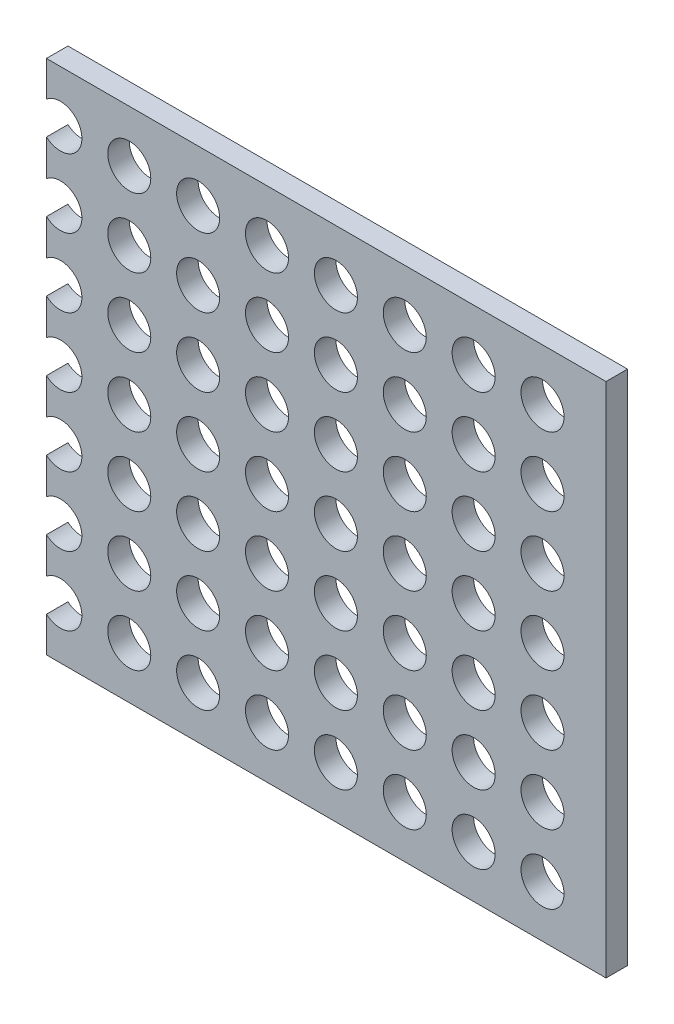
from build123d import *

# Parameters (mm, degrees)
SKETCH1_W           = 82.55
SKETCH1_H           = 76.2
BOSS_EXTRUDE1_DEPTH = 3.175
LPATTERN1_COUNT     = 5
LPATTERN1_PITCH     = 10.16
LPATTERN1_COL_COUNT = 4
LPATTERN1_COL_PITCH = 10.16
LPATTERN2_COUNT     = 4
LPATTERN2_PITCH     = 10.16
LPATTERN2_COL_COUNT = 4
LPATTERN2_COL_PITCH = 10.16


with BuildPart() as part:
    # Sketch1 → Boss-Extrude1 (new body)
    with BuildSketch(Plane.XY):
        Rectangle(SKETCH1_W, SKETCH1_H)
    extrude(amount=BOSS_EXTRUDE1_DEPTH)

    # Sketch3 → 1/4 (0.25) Diameter Hole1 (revolve, cut)
    with BuildSketch(Plane(origin=(-8.7376, 0, 3.175), x_dir=(0, -1, 0), z_dir=(1, 0, 0))):
        Polygon((0, 0), (0, 17.147732465), (3.175, 15.24), (3.175, 0), align=None)
    f_1_4_0_25_diameter_hole1 = revolve(axis=Axis((-8.7376, 0, 9.525), (0, 0, -1)), mode=Mode.SUBTRACT)

    # LPattern1: 1/4 (0.25) Diameter Hole1 ×5
    with Locations(*[(i * LPATTERN1_PITCH, 0, 0) for i in range(1, LPATTERN1_COUNT)]):
        add(f_1_4_0_25_diameter_hole1, mode=Mode.SUBTRACT)

    # LPattern1 col: 1/4 (0.25) Diameter Hole1 ×4
    with Locations(*[(-i * LPATTERN1_COL_PITCH, 0, 0) for i in range(1, LPATTERN1_COL_COUNT)]):
        add(f_1_4_0_25_diameter_hole1, mode=Mode.SUBTRACT)

    # LPattern2: 1/4 (0.25) Diameter Hole1 ×4
    with Locations(*[(0, -i * LPATTERN2_PITCH, 0) for i in range(1, LPATTERN2_COUNT)]):
        add(f_1_4_0_25_diameter_hole1, mode=Mode.SUBTRACT)

    # LPattern2 copy 1 sketch → LPattern2 copy 1 (revolve, cut)
    with BuildSketch(Plane(origin=(1.4224, -10.16, 3.175), x_dir=(0, -1, 0), z_dir=(1, 0, 0))):
        Polygon((0, 0), (0, 17.147732465), (3.175, 15.24), (3.175, 0), align=None)
    revolve(axis=Axis((1.4224, -10.16, 9.525), (0, 0, -1)), mode=Mode.SUBTRACT)

    # LPattern2 copy 2 sketch → LPattern2 copy 2 (revolve, cut)
    with BuildSketch(Plane(origin=(1.4224, -20.32, 3.175), x_dir=(0, -1, 0), z_dir=(1, 0, 0))):
        Polygon((0, 0), (0, 17.147732465), (3.175, 15.24), (3.175, 0), align=None)
    revolve(axis=Axis((1.4224, -20.32, 9.525), (0, 0, -1)), mode=Mode.SUBTRACT)

    # LPattern2 copy 3 sketch → LPattern2 copy 3 (revolve, cut)
    with BuildSketch(Plane(origin=(1.4224, -30.48, 3.175), x_dir=(0, -1, 0), z_dir=(1, 0, 0))):
        Polygon((0, 0), (0, 17.147732465), (3.175, 15.24), (3.175, 0), align=None)
    revolve(axis=Axis((1.4224, -30.48, 9.525), (0, 0, -1)), mode=Mode.SUBTRACT)

    # LPattern2 copy 4 sketch → LPattern2 copy 4 (revolve, cut)
    with BuildSketch(Plane(origin=(11.5824, -10.16, 3.175), x_dir=(0, -1, 0), z_dir=(1, 0, 0))):
        Polygon((0, 0), (0, 17.147732465), (3.175, 15.24), (3.175, 0), align=None)
    revolve(axis=Axis((11.5824, -10.16, 9.525), (0, 0, -1)), mode=Mode.SUBTRACT)

    # LPattern2 copy 5 sketch → LPattern2 copy 5 (revolve, cut)
    with BuildSketch(Plane(origin=(11.5824, -20.32, 3.175), x_dir=(0, -1, 0), z_dir=(1, 0, 0))):
        Polygon((0, 0), (0, 17.147732465), (3.175, 15.24), (3.175, 0), align=None)
    revolve(axis=Axis((11.5824, -20.32, 9.525), (0, 0, -1)), mode=Mode.SUBTRACT)

    # LPattern2 copy 6 sketch → LPattern2 copy 6 (revolve, cut)
    with BuildSketch(Plane(origin=(11.5824, -30.48, 3.175), x_dir=(0, -1, 0), z_dir=(1, 0, 0))):
        Polygon((0, 0), (0, 17.147732465), (3.175, 15.24), (3.175, 0), align=None)
    revolve(axis=Axis((11.5824, -30.48, 9.525), (0, 0, -1)), mode=Mode.SUBTRACT)

    # LPattern2 copy 7 sketch → LPattern2 copy 7 (revolve, cut)
    with BuildSketch(Plane(origin=(21.7424, -10.16, 3.175), x_dir=(0, -1, 0), z_dir=(1, 0, 0))):
        Polygon((0, 0), (0, 17.147732465), (3.175, 15.24), (3.175, 0), align=None)
    revolve(axis=Axis((21.7424, -10.16, 9.525), (0, 0, -1)), mode=Mode.SUBTRACT)

    # LPattern2 copy 8 sketch → LPattern2 copy 8 (revolve, cut)
    with BuildSketch(Plane(origin=(21.7424, -20.32, 3.175), x_dir=(0, -1, 0), z_dir=(1, 0, 0))):
        Polygon((0, 0), (0, 17.147732465), (3.175, 15.24), (3.175, 0), align=None)
    revolve(axis=Axis((21.7424, -20.32, 9.525), (0, 0, -1)), mode=Mode.SUBTRACT)

    # LPattern2 copy 9 sketch → LPattern2 copy 9 (revolve, cut)
    with BuildSketch(Plane(origin=(21.7424, -30.48, 3.175), x_dir=(0, -1, 0), z_dir=(1, 0, 0))):
        Polygon((0, 0), (0, 17.147732465), (3.175, 15.24), (3.175, 0), align=None)
    revolve(axis=Axis((21.7424, -30.48, 9.525), (0, 0, -1)), mode=Mode.SUBTRACT)

    # LPattern2 copy 10 sketch → LPattern2 copy 10 (revolve, cut)
    with BuildSketch(Plane(origin=(31.9024, -10.16, 3.175), x_dir=(0, -1, 0), z_dir=(1, 0, 0))):
        Polygon((0, 0), (0, 17.147732465), (3.175, 15.24), (3.175, 0), align=None)
    revolve(axis=Axis((31.9024, -10.16, 9.525), (0, 0, -1)), mode=Mode.SUBTRACT)

    # LPattern2 copy 11 sketch → LPattern2 copy 11 (revolve, cut)
    with BuildSketch(Plane(origin=(31.9024, -20.32, 3.175), x_dir=(0, -1, 0), z_dir=(1, 0, 0))):
        Polygon((0, 0), (0, 17.147732465), (3.175, 15.24), (3.175, 0), align=None)
    revolve(axis=Axis((31.9024, -20.32, 9.525), (0, 0, -1)), mode=Mode.SUBTRACT)

    # LPattern2 copy 12 sketch → LPattern2 copy 12 (revolve, cut)
    with BuildSketch(Plane(origin=(31.9024, -30.48, 3.175), x_dir=(0, -1, 0), z_dir=(1, 0, 0))):
        Polygon((0, 0), (0, 17.147732465), (3.175, 15.24), (3.175, 0), align=None)
    revolve(axis=Axis((31.9024, -30.48, 9.525), (0, 0, -1)), mode=Mode.SUBTRACT)

    # LPattern2 copy 13 sketch → LPattern2 copy 13 (revolve, cut)
    with BuildSketch(Plane(origin=(-18.8976, -10.16, 3.175), x_dir=(0, -1, 0), z_dir=(1, 0, 0))):
        Polygon((0, 0), (0, 17.147732465), (3.175, 15.24), (3.175, 0), align=None)
    revolve(axis=Axis((-18.8976, -10.16, 9.525), (0, 0, -1)), mode=Mode.SUBTRACT)

    # LPattern2 copy 14 sketch → LPattern2 copy 14 (revolve, cut)
    with BuildSketch(Plane(origin=(-18.8976, -20.32, 3.175), x_dir=(0, -1, 0), z_dir=(1, 0, 0))):
        Polygon((0, 0), (0, 17.147732465), (3.175, 15.24), (3.175, 0), align=None)
    revolve(axis=Axis((-18.8976, -20.32, 9.525), (0, 0, -1)), mode=Mode.SUBTRACT)

    # LPattern2 copy 15 sketch → LPattern2 copy 15 (revolve, cut)
    with BuildSketch(Plane(origin=(-18.8976, -30.48, 3.175), x_dir=(0, -1, 0), z_dir=(1, 0, 0))):
        Polygon((0, 0), (0, 17.147732465), (3.175, 15.24), (3.175, 0), align=None)
    revolve(axis=Axis((-18.8976, -30.48, 9.525), (0, 0, -1)), mode=Mode.SUBTRACT)

    # LPattern2 copy 16 sketch → LPattern2 copy 16 (revolve, cut)
    with BuildSketch(Plane(origin=(-29.0576, -10.16, 3.175), x_dir=(0, -1, 0), z_dir=(1, 0, 0))):
        Polygon((0, 0), (0, 17.147732465), (3.175, 15.24), (3.175, 0), align=None)
    revolve(axis=Axis((-29.0576, -10.16, 9.525), (0, 0, -1)), mode=Mode.SUBTRACT)

    # LPattern2 copy 17 sketch → LPattern2 copy 17 (revolve, cut)
    with BuildSketch(Plane(origin=(-29.0576, -20.32, 3.175), x_dir=(0, -1, 0), z_dir=(1, 0, 0))):
        Polygon((0, 0), (0, 17.147732465), (3.175, 15.24), (3.175, 0), align=None)
    revolve(axis=Axis((-29.0576, -20.32, 9.525), (0, 0, -1)), mode=Mode.SUBTRACT)

    # LPattern2 copy 18 sketch → LPattern2 copy 18 (revolve, cut)
    with BuildSketch(Plane(origin=(-29.0576, -30.48, 3.175), x_dir=(0, -1, 0), z_dir=(1, 0, 0))):
        Polygon((0, 0), (0, 17.147732465), (3.175, 15.24), (3.175, 0), align=None)
    revolve(axis=Axis((-29.0576, -30.48, 9.525), (0, 0, -1)), mode=Mode.SUBTRACT)

    # LPattern2 copy 19 sketch → LPattern2 copy 19 (revolve, cut)
    with BuildSketch(Plane(origin=(-39.2176, -10.16, 3.175), x_dir=(0, -1, 0), z_dir=(1, 0, 0))):
        Polygon((0, 0), (0, 17.147732465), (3.175, 15.24), (3.175, 0), align=None)
    revolve(axis=Axis((-39.2176, -10.16, 9.525), (0, 0, -1)), mode=Mode.SUBTRACT)

    # LPattern2 copy 20 sketch → LPattern2 copy 20 (revolve, cut)
    with BuildSketch(Plane(origin=(-39.2176, -20.32, 3.175), x_dir=(0, -1, 0), z_dir=(1, 0, 0))):
        Polygon((0, 0), (0, 17.147732465), (3.175, 15.24), (3.175, 0), align=None)
    revolve(axis=Axis((-39.2176, -20.32, 9.525), (0, 0, -1)), mode=Mode.SUBTRACT)

    # LPattern2 copy 21 sketch → LPattern2 copy 21 (revolve, cut)
    with BuildSketch(Plane(origin=(-39.2176, -30.48, 3.175), x_dir=(0, -1, 0), z_dir=(1, 0, 0))):
        Polygon((0, 0), (0, 17.147732465), (3.175, 15.24), (3.175, 0), align=None)
    revolve(axis=Axis((-39.2176, -30.48, 9.525), (0, 0, -1)), mode=Mode.SUBTRACT)

    # LPattern2 col: 1/4 (0.25) Diameter Hole1 ×4
    with Locations(*[(0, i * LPATTERN2_COL_PITCH, 0) for i in range(1, LPATTERN2_COL_COUNT)]):
        add(f_1_4_0_25_diameter_hole1, mode=Mode.SUBTRACT)

    # LPattern2 col copy 1 sketch → LPattern2 col copy 1 (revolve, cut)
    with BuildSketch(Plane(origin=(1.4224, 10.16, 3.175), x_dir=(0, -1, 0), z_dir=(1, 0, 0))):
        Polygon((0, 0), (0, 17.147732465), (3.175, 15.24), (3.175, 0), align=None)
    revolve(axis=Axis((1.4224, 10.16, 9.525), (0, 0, -1)), mode=Mode.SUBTRACT)

    # LPattern2 col copy 2 sketch → LPattern2 col copy 2 (revolve, cut)
    with BuildSketch(Plane(origin=(1.4224, 20.32, 3.175), x_dir=(0, -1, 0), z_dir=(1, 0, 0))):
        Polygon((0, 0), (0, 17.147732465), (3.175, 15.24), (3.175, 0), align=None)
    revolve(axis=Axis((1.4224, 20.32, 9.525), (0, 0, -1)), mode=Mode.SUBTRACT)

    # LPattern2 col copy 3 sketch → LPattern2 col copy 3 (revolve, cut)
    with BuildSketch(Plane(origin=(1.4224, 30.48, 3.175), x_dir=(0, -1, 0), z_dir=(1, 0, 0))):
        Polygon((0, 0), (0, 17.147732465), (3.175, 15.24), (3.175, 0), align=None)
    revolve(axis=Axis((1.4224, 30.48, 9.525), (0, 0, -1)), mode=Mode.SUBTRACT)

    # LPattern2 col copy 4 sketch → LPattern2 col copy 4 (revolve, cut)
    with BuildSketch(Plane(origin=(11.5824, 10.16, 3.175), x_dir=(0, -1, 0), z_dir=(1, 0, 0))):
        Polygon((0, 0), (0, 17.147732465), (3.175, 15.24), (3.175, 0), align=None)
    revolve(axis=Axis((11.5824, 10.16, 9.525), (0, 0, -1)), mode=Mode.SUBTRACT)

    # LPattern2 col copy 5 sketch → LPattern2 col copy 5 (revolve, cut)
    with BuildSketch(Plane(origin=(11.5824, 20.32, 3.175), x_dir=(0, -1, 0), z_dir=(1, 0, 0))):
        Polygon((0, 0), (0, 17.147732465), (3.175, 15.24), (3.175, 0), align=None)
    revolve(axis=Axis((11.5824, 20.32, 9.525), (0, 0, -1)), mode=Mode.SUBTRACT)

    # LPattern2 col copy 6 sketch → LPattern2 col copy 6 (revolve, cut)
    with BuildSketch(Plane(origin=(11.5824, 30.48, 3.175), x_dir=(0, -1, 0), z_dir=(1, 0, 0))):
        Polygon((0, 0), (0, 17.147732465), (3.175, 15.24), (3.175, 0), align=None)
    revolve(axis=Axis((11.5824, 30.48, 9.525), (0, 0, -1)), mode=Mode.SUBTRACT)

    # LPattern2 col copy 7 sketch → LPattern2 col copy 7 (revolve, cut)
    with BuildSketch(Plane(origin=(21.7424, 10.16, 3.175), x_dir=(0, -1, 0), z_dir=(1, 0, 0))):
        Polygon((0, 0), (0, 17.147732465), (3.175, 15.24), (3.175, 0), align=None)
    revolve(axis=Axis((21.7424, 10.16, 9.525), (0, 0, -1)), mode=Mode.SUBTRACT)

    # LPattern2 col copy 8 sketch → LPattern2 col copy 8 (revolve, cut)
    with BuildSketch(Plane(origin=(21.7424, 20.32, 3.175), x_dir=(0, -1, 0), z_dir=(1, 0, 0))):
        Polygon((0, 0), (0, 17.147732465), (3.175, 15.24), (3.175, 0), align=None)
    revolve(axis=Axis((21.7424, 20.32, 9.525), (0, 0, -1)), mode=Mode.SUBTRACT)

    # LPattern2 col copy 9 sketch → LPattern2 col copy 9 (revolve, cut)
    with BuildSketch(Plane(origin=(21.7424, 30.48, 3.175), x_dir=(0, -1, 0), z_dir=(1, 0, 0))):
        Polygon((0, 0), (0, 17.147732465), (3.175, 15.24), (3.175, 0), align=None)
    revolve(axis=Axis((21.7424, 30.48, 9.525), (0, 0, -1)), mode=Mode.SUBTRACT)

    # LPattern2 col copy 10 sketch → LPattern2 col copy 10 (revolve, cut)
    with BuildSketch(Plane(origin=(31.9024, 10.16, 3.175), x_dir=(0, -1, 0), z_dir=(1, 0, 0))):
        Polygon((0, 0), (0, 17.147732465), (3.175, 15.24), (3.175, 0), align=None)
    revolve(axis=Axis((31.9024, 10.16, 9.525), (0, 0, -1)), mode=Mode.SUBTRACT)

    # LPattern2 col copy 11 sketch → LPattern2 col copy 11 (revolve, cut)
    with BuildSketch(Plane(origin=(31.9024, 20.32, 3.175), x_dir=(0, -1, 0), z_dir=(1, 0, 0))):
        Polygon((0, 0), (0, 17.147732465), (3.175, 15.24), (3.175, 0), align=None)
    revolve(axis=Axis((31.9024, 20.32, 9.525), (0, 0, -1)), mode=Mode.SUBTRACT)

    # LPattern2 col copy 12 sketch → LPattern2 col copy 12 (revolve, cut)
    with BuildSketch(Plane(origin=(31.9024, 30.48, 3.175), x_dir=(0, -1, 0), z_dir=(1, 0, 0))):
        Polygon((0, 0), (0, 17.147732465), (3.175, 15.24), (3.175, 0), align=None)
    revolve(axis=Axis((31.9024, 30.48, 9.525), (0, 0, -1)), mode=Mode.SUBTRACT)

    # LPattern2 col copy 13 sketch → LPattern2 col copy 13 (revolve, cut)
    with BuildSketch(Plane(origin=(-18.8976, 10.16, 3.175), x_dir=(0, -1, 0), z_dir=(1, 0, 0))):
        Polygon((0, 0), (0, 17.147732465), (3.175, 15.24), (3.175, 0), align=None)
    revolve(axis=Axis((-18.8976, 10.16, 9.525), (0, 0, -1)), mode=Mode.SUBTRACT)

    # LPattern2 col copy 14 sketch → LPattern2 col copy 14 (revolve, cut)
    with BuildSketch(Plane(origin=(-18.8976, 20.32, 3.175), x_dir=(0, -1, 0), z_dir=(1, 0, 0))):
        Polygon((0, 0), (0, 17.147732465), (3.175, 15.24), (3.175, 0), align=None)
    revolve(axis=Axis((-18.8976, 20.32, 9.525), (0, 0, -1)), mode=Mode.SUBTRACT)

    # LPattern2 col copy 15 sketch → LPattern2 col copy 15 (revolve, cut)
    with BuildSketch(Plane(origin=(-18.8976, 30.48, 3.175), x_dir=(0, -1, 0), z_dir=(1, 0, 0))):
        Polygon((0, 0), (0, 17.147732465), (3.175, 15.24), (3.175, 0), align=None)
    revolve(axis=Axis((-18.8976, 30.48, 9.525), (0, 0, -1)), mode=Mode.SUBTRACT)

    # LPattern2 col copy 16 sketch → LPattern2 col copy 16 (revolve, cut)
    with BuildSketch(Plane(origin=(-29.0576, 10.16, 3.175), x_dir=(0, -1, 0), z_dir=(1, 0, 0))):
        Polygon((0, 0), (0, 17.147732465), (3.175, 15.24), (3.175, 0), align=None)
    revolve(axis=Axis((-29.0576, 10.16, 9.525), (0, 0, -1)), mode=Mode.SUBTRACT)

    # LPattern2 col copy 17 sketch → LPattern2 col copy 17 (revolve, cut)
    with BuildSketch(Plane(origin=(-29.0576, 20.32, 3.175), x_dir=(0, -1, 0), z_dir=(1, 0, 0))):
        Polygon((0, 0), (0, 17.147732465), (3.175, 15.24), (3.175, 0), align=None)
    revolve(axis=Axis((-29.0576, 20.32, 9.525), (0, 0, -1)), mode=Mode.SUBTRACT)

    # LPattern2 col copy 18 sketch → LPattern2 col copy 18 (revolve, cut)
    with BuildSketch(Plane(origin=(-29.0576, 30.48, 3.175), x_dir=(0, -1, 0), z_dir=(1, 0, 0))):
        Polygon((0, 0), (0, 17.147732465), (3.175, 15.24), (3.175, 0), align=None)
    revolve(axis=Axis((-29.0576, 30.48, 9.525), (0, 0, -1)), mode=Mode.SUBTRACT)

    # LPattern2 col copy 19 sketch → LPattern2 col copy 19 (revolve, cut)
    with BuildSketch(Plane(origin=(-39.2176, 10.16, 3.175), x_dir=(0, -1, 0), z_dir=(1, 0, 0))):
        Polygon((0, 0), (0, 17.147732465), (3.175, 15.24), (3.175, 0), align=None)
    revolve(axis=Axis((-39.2176, 10.16, 9.525), (0, 0, -1)), mode=Mode.SUBTRACT)

    # LPattern2 col copy 20 sketch → LPattern2 col copy 20 (revolve, cut)
    with BuildSketch(Plane(origin=(-39.2176, 20.32, 3.175), x_dir=(0, -1, 0), z_dir=(1, 0, 0))):
        Polygon((0, 0), (0, 17.147732465), (3.175, 15.24), (3.175, 0), align=None)
    revolve(axis=Axis((-39.2176, 20.32, 9.525), (0, 0, -1)), mode=Mode.SUBTRACT)

    # LPattern2 col copy 21 sketch → LPattern2 col copy 21 (revolve, cut)
    with BuildSketch(Plane(origin=(-39.2176, 30.48, 3.175), x_dir=(0, -1, 0), z_dir=(1, 0, 0))):
        Polygon((0, 0), (0, 17.147732465), (3.175, 15.24), (3.175, 0), align=None)
    revolve(axis=Axis((-39.2176, 30.48, 9.525), (0, 0, -1)), mode=Mode.SUBTRACT)


solid = part.part
